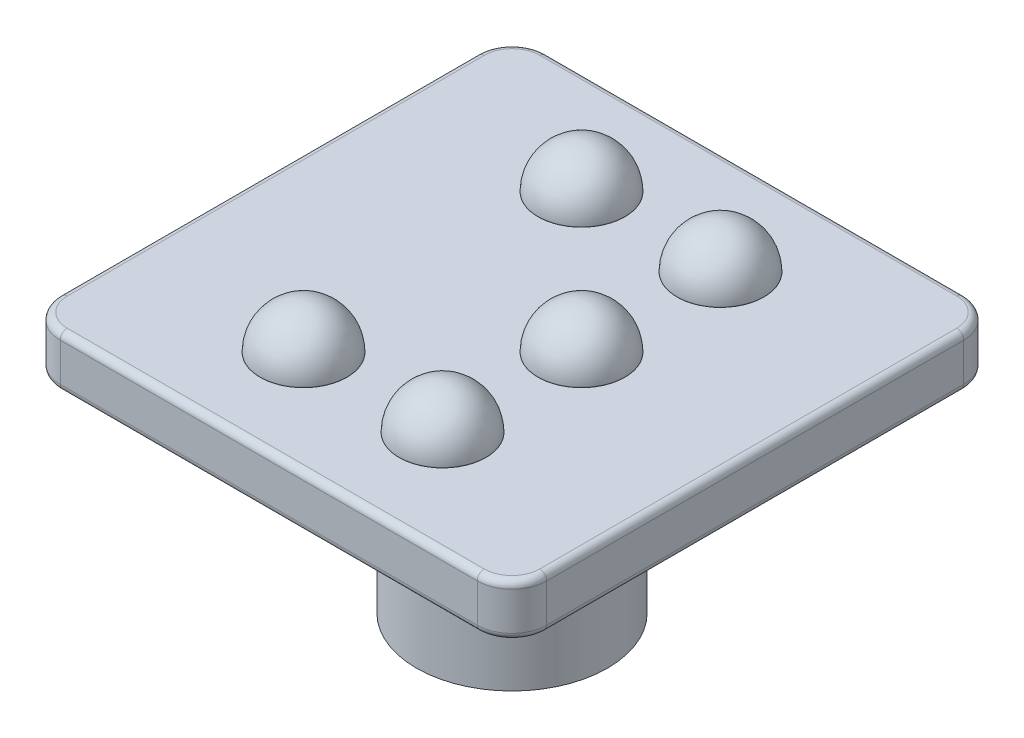
from build123d import *

# Parameters (mm, degrees)
BOSS_EXTRUDE1_DEPTH = 1.5
SKETCH2_R           = 2.75
BOSS_EXTRUDE2_DEPTH = 6
SKETCH3_W           = 1.1
SKETCH3_H           = 1.45
SKETCH3_W_2         = 1.45
SKETCH3_H_2         = 1.1
CUT_EXTRUDE1_DEPTH  = 6
CHAMFER1_SIZE       = 0.3
FILLET1_R           = 1
SKETCH4_R           = 1.25
BOSS_EXTRUDE3_DEPTH = 0.01
DOME1_FACE_RADIUS   = 1.25
DOME1_HEIGHT        = 1.25
DOME2_FACE_RADIUS   = 1.25
DOME2_HEIGHT        = 1.25
DOME4_FACE_RADIUS   = 1.25
DOME4_HEIGHT        = 1.25
DOME5_FACE_RADIUS   = 1.25
DOME5_HEIGHT        = 1.25
DOME6_FACE_RADIUS   = 1.25
DOME6_HEIGHT        = 1.25
FILLET3_R           = 0.2


with BuildPart() as part:
    # Sketch1 → Boss-Extrude1 (new body)
    with BuildSketch(Plane(origin=(0, 0, 0), x_dir=(1, 0, 0), z_dir=(0, 1, 0))):
        with BuildLine():
            Line((-7.324675649, 4.396717546), (4.675324351, 4.396717546))
            ThreePointArc((4.675324351, 4.396717546), (5.382431132, 4.103824327), (5.675324351, 3.396717546))
            Line((5.675324351, 3.396717546), (5.675324351, -8.603282454))
            ThreePointArc((5.675324351, -8.603282454), (5.382431132, -9.310389235), (4.675324351, -9.603282454))
            Line((4.675324351, -9.603282454), (-7.324675649, -9.603282454))
            ThreePointArc((-7.324675649, -9.603282454), (-8.03178243, -9.310389235), (-8.324675649, -8.603282454))
            Line((-8.324675649, -8.603282454), (-8.324675649, 3.396717546))
            ThreePointArc((-8.324675649, 3.396717546), (-8.03178243, 4.103824327), (-7.324675649, 4.396717546))
        make_face()
    extrude(amount=BOSS_EXTRUDE1_DEPTH)

    # Sketch2 → Boss-Extrude2 (add)
    with BuildSketch(Plane.XZ):
        with Locations(Location((-1.324675649, 2.603282454, 0), (0, 0, 270))):
            Circle(SKETCH2_R)
    extrude(amount=BOSS_EXTRUDE2_DEPTH)

    # Sketch3 → Cut-Extrude1 (cut)
    with BuildSketch(Plane.XZ.offset(6)):
        with Locations((-1.324675649, 3.878282454)):
            Rectangle(SKETCH3_W, SKETCH3_H)
        with Locations((-0.049675649, 2.603282454)):
            Rectangle(SKETCH3_W_2, SKETCH3_H_2)
        with Locations((-1.324675649, 2.603282454)):
            Rectangle(SKETCH3_W, SKETCH3_H_2)
        with Locations((-2.599675649, 2.603282454)):
            Rectangle(SKETCH3_W_2, SKETCH3_H_2)
        with Locations((-1.324675649, 1.328282454)):
            Rectangle(SKETCH3_W, SKETCH3_H)
    extrude(amount=-CUT_EXTRUDE1_DEPTH, mode=Mode.SUBTRACT)

    # Chamfer1
    chamfer1_edges = [part.edges().sort_by_distance(p)[0] for p in [
        (-0.774675649, -6, 3.878282454),
        (-0.049675649, -6, 3.153282454),
        (0.675324351, -6, 2.603282454),
        (-0.774675649, -6, 1.328282454),
        (-2.599675649, -6, 3.153282454),
        (-1.324675649, -6, 4.603282454),
        (-1.874675649, -6, 3.878282454),
        (-3.324675649, -6, 2.603282454),
        (-2.599675649, -6, 2.053282454),
        (-1.874675649, -6, 1.328282454),
        (-1.324675649, -6, 0.603282454),
        (-0.049675649, -6, 2.053282454),
    ]]
    chamfer(chamfer1_edges, length=CHAMFER1_SIZE)

    # Fillet1
    fillet1_edges = [part.edges().sort_by_distance(p)[0] for p in [
        (-1.324675649, 0, 5.353282454),
    ]]
    fillet(fillet1_edges, radius=FILLET1_R)

    # Sketch4 → Boss-Extrude3 (add)
    with BuildSketch(Plane(origin=(0, 1.5, 0), x_dir=(1, 0, 0), z_dir=(0, 1, 0))):
        with Locations(Location((-3.324675649, 1.396717546, 0), (0, 0, 90))):
            Circle(SKETCH4_R)
        with Locations(Location((0.675324351, -2.603282454, 0), (0, 0, 90))):
            Circle(SKETCH4_R)
        with Locations(Location((-3.324675649, -6.603282454, 0), (0, 0, 90))):
            Circle(SKETCH4_R)
        with Locations(Location((0.675324351, -6.603282454, 0), (0, 0, 90))):
            Circle(SKETCH4_R)
        with Locations(Location((0.675324351, 1.396717546, 0), (0, 0, 90))):
            Circle(SKETCH4_R)
    extrude(amount=BOSS_EXTRUDE3_DEPTH)

    # Dome1: a dome of height H over a round flat face of radius A is a cap of a sphere of radius (A * A + H * H) / (2 * H)
    dome1_r = (DOME1_FACE_RADIUS * DOME1_FACE_RADIUS + DOME1_HEIGHT * DOME1_HEIGHT) / (2 * DOME1_HEIGHT)
    dome1_base = Plane((-3.324675649, 1.51, -1.396717546), z_dir=(0, 1, 0))
    with Locations(dome1_base.offset(DOME1_HEIGHT - dome1_r)):
        dome1_ball = Sphere(dome1_r, mode=Mode.PRIVATE)
    add(split(dome1_ball, bisect_by=dome1_base, keep=Keep.TOP, mode=Mode.PRIVATE))

    # Dome2: a dome of height H over a round flat face of radius A is a cap of a sphere of radius (A * A + H * H) / (2 * H)
    dome2_r = (DOME2_FACE_RADIUS * DOME2_FACE_RADIUS + DOME2_HEIGHT * DOME2_HEIGHT) / (2 * DOME2_HEIGHT)
    dome2_base = Plane((0.675324351, 1.51, -1.396717546), z_dir=(0, 1, 0))
    with Locations(dome2_base.offset(DOME2_HEIGHT - dome2_r)):
        dome2_ball = Sphere(dome2_r, mode=Mode.PRIVATE)
    add(split(dome2_ball, bisect_by=dome2_base, keep=Keep.TOP, mode=Mode.PRIVATE))

    # Dome4: a dome of height H over a round flat face of radius A is a cap of a sphere of radius (A * A + H * H) / (2 * H)
    dome4_r = (DOME4_FACE_RADIUS * DOME4_FACE_RADIUS + DOME4_HEIGHT * DOME4_HEIGHT) / (2 * DOME4_HEIGHT)
    dome4_base = Plane((0.675324351, 1.51, 2.603282454), z_dir=(0, 1, 0))
    with Locations(dome4_base.offset(DOME4_HEIGHT - dome4_r)):
        dome4_ball = Sphere(dome4_r, mode=Mode.PRIVATE)
    add(split(dome4_ball, bisect_by=dome4_base, keep=Keep.TOP, mode=Mode.PRIVATE))

    # Dome5: a dome of height H over a round flat face of radius A is a cap of a sphere of radius (A * A + H * H) / (2 * H)
    dome5_r = (DOME5_FACE_RADIUS * DOME5_FACE_RADIUS + DOME5_HEIGHT * DOME5_HEIGHT) / (2 * DOME5_HEIGHT)
    dome5_base = Plane((-3.324675649, 1.51, 6.603282454), z_dir=(0, 1, 0))
    with Locations(dome5_base.offset(DOME5_HEIGHT - dome5_r)):
        dome5_ball = Sphere(dome5_r, mode=Mode.PRIVATE)
    add(split(dome5_ball, bisect_by=dome5_base, keep=Keep.TOP, mode=Mode.PRIVATE))

    # Dome6: a dome of height H over a round flat face of radius A is a cap of a sphere of radius (A * A + H * H) / (2 * H)
    dome6_r = (DOME6_FACE_RADIUS * DOME6_FACE_RADIUS + DOME6_HEIGHT * DOME6_HEIGHT) / (2 * DOME6_HEIGHT)
    dome6_base = Plane((0.675324351, 1.51, 6.603282454), z_dir=(0, 1, 0))
    with Locations(dome6_base.offset(DOME6_HEIGHT - dome6_r)):
        dome6_ball = Sphere(dome6_r, mode=Mode.PRIVATE)
    add(split(dome6_ball, bisect_by=dome6_base, keep=Keep.TOP, mode=Mode.PRIVATE))

    # Fillet3
    fillet3_edges = [part.edges().sort_by_distance(p)[0] for p in [
        (5.382431132, 1.5, 9.310389235),
        (-1.324675649, 0, 9.603282454),
        (-8.03178243, 0, 9.310389235),
        (5.675324351, 1.5, 2.603282454),
        (5.382431132, 1.5, -4.103824327),
        (-1.324675649, 1.5, -4.396717546),
        (-8.03178243, 1.5, -4.103824327),
        (-8.324675649, 1.5, 2.603282454),
        (-8.03178243, 1.5, 9.310389235),
        (-1.324675649, 1.5, 9.603282454),
        (-8.324675649, 0, 2.603282454),
        (-8.03178243, 0, -4.103824327),
        (-1.324675649, 0, -4.396717546),
        (5.382431132, 0, -4.103824327),
        (5.675324351, 0, 2.603282454),
        (5.382431132, 0, 9.310389235),
    ]]
    fillet(fillet3_edges, radius=FILLET3_R)


solid = part.part
